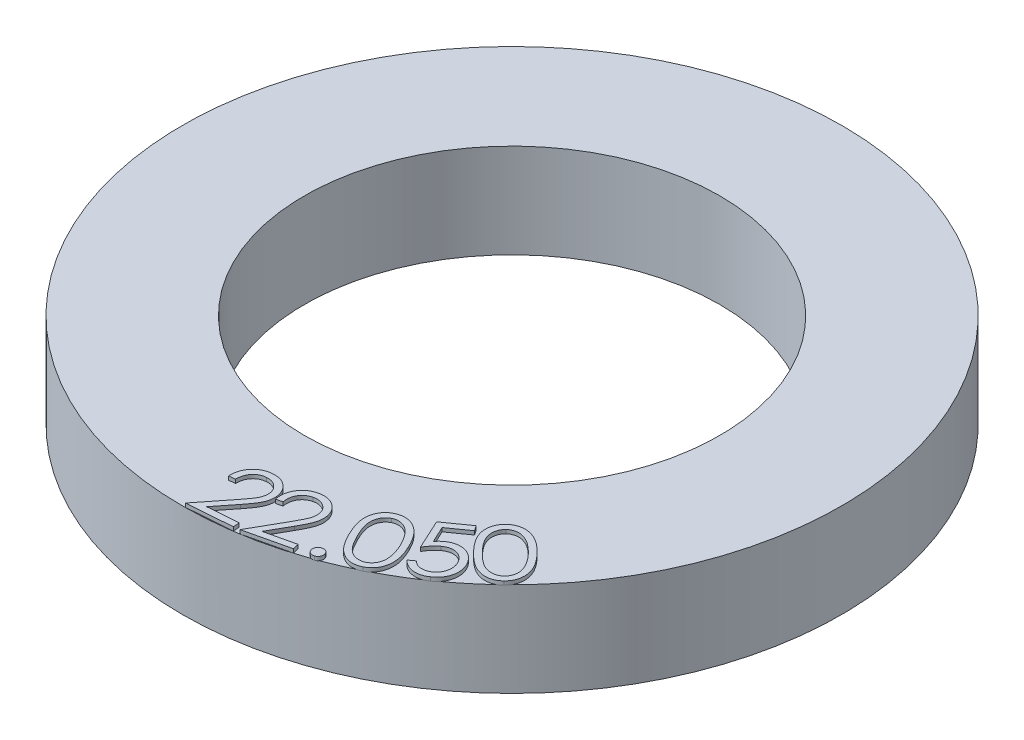
from build123d import *

# Parameters (mm, degrees)
SKETCH1_R           = 17.5
SKETCH1_R_2         = 11.025
BOSS_EXTRUDE1_DEPTH = 5
BOSS_EXTRUDE3_DEPTH = 0.2


with BuildPart() as part:
    # Sketch1 → Boss-Extrude1 (new body)
    with BuildSketch(Plane(origin=(0, 0, 0), x_dir=(1, 0, 0), z_dir=(0, 1, 0))):
        Circle(SKETCH1_R)
        Circle(SKETCH1_R_2, mode=Mode.SUBTRACT)
    extrude(amount=BOSS_EXTRUDE1_DEPTH)

    # Sketch3 → Boss-Extrude3 (add)
    # profile 1 of 6: a face of its own
    with BuildSketch(Plane(origin=(0, 5, 0), x_dir=(1, 0, 0), z_dir=(0, 1, 0))):
        with BuildLine():
            Line((0.377203526, -15.06640625), (0.043469551, -15.092347756))
            add(Edge.make_bspline(
                [(0.043469551, -15.092347756), (0.042203297, -15.050032699), (0.039723419, -14.96716131), (0.049638285, -14.844981972), (0.067688405, -14.727624407), (0.098455755, -14.61556583), (0.138504263, -14.508522308), (0.188279293, -14.405930448), (0.249943807, -14.309195828), (0.320224245, -14.217586795), (0.399116148, -14.133937543), (0.484222111, -14.059456033), (0.574336923, -13.993992114), (0.671078969, -13.940092371), (0.773224869, -13.895612995), (0.881084602, -13.861423192), (0.994390789, -13.836174987), (1.072362547, -13.828578994), (1.111979167, -13.824719551)],
                knots=[0, 0, 0, 0, 1.099165856, 2.152647473, 3.179901334, 4.180092559, 5.165857059, 6.14623908, 7.136854445, 8.141313093, 9.142222958, 10.119044223, 11.076246807, 12.030555843, 12.990566437, 13.966122304, 14.966608418, 16, 16, 16, 16], degree=3))
            add(Edge.make_bspline(
                [(1.111979167, -13.824719551), (1.151232363, -13.822614291), (1.227892409, -13.818502795), (1.341072803, -13.824300473), (1.449209712, -13.840047194), (1.552456645, -13.867170925), (1.650809554, -13.903432336), (1.744251767, -13.950064736), (1.832189716, -14.007297288), (1.914237577, -14.07371881), (1.989801801, -14.146775331), (2.056191283, -14.225750107), (2.115236363, -14.307662186), (2.163673815, -14.394967734), (2.203994369, -14.485852699), (2.23381166, -14.581483532), (2.256306856, -14.680631266), (2.263224051, -14.74868976), (2.266726763, -14.783153045)],
                knots=[0, 0, 0, 0, 1.125255338, 2.197582177, 3.23984224, 4.249678898, 5.249348258, 6.237204937, 7.234226399, 8.248247252, 9.256507582, 10.239567543, 11.199778339, 12.143800945, 13.093950023, 14.042329097, 15.008679649, 16, 16, 16, 16], degree=3))
            add(Edge.make_bspline(
                [(2.266726763, -14.783153045), (2.268653871, -14.83201524), (2.272472697, -14.928842275), (2.256591946, -15.073272294), (2.221554197, -15.213909987), (2.177756368, -15.329043673), (2.13210079, -15.422970742), (2.088829613, -15.499650514), (2.039151976, -15.583479859), (1.980752569, -15.67318269), (1.913642882, -15.76882397), (1.840613729, -15.872212721), (1.757921696, -15.980725817), (1.700055339, -16.055042687), (1.670072115, -16.093549679)],
                knots=[0, 0, 0, 0, 1.190284496, 2.358709392, 3.525773572, 4.713480732, 5.352743619, 6.06901355, 6.858115264, 7.726847504, 8.676217017, 9.704931629, 10.810819393, 12, 12, 12, 12], degree=3))
            Line((1.670072115, -16.093549679), (0.875701122, -17.094751603))
            Line((0.875701122, -17.094751603), (2.482672276, -16.971354167))
            Line((2.482672276, -16.971354167), (2.508613782, -17.307191506))
            Line((2.508613782, -17.307191506), (0.14443109, -17.488782051))
            Line((0.14443109, -17.488782051), (1.363681891, -15.949819712))
            add(Edge.make_bspline(
                [(1.363681891, -15.949819712), (1.393527022, -15.912554926), (1.450782044, -15.841066007), (1.530584566, -15.73612355), (1.602999147, -15.639675593), (1.666852925, -15.550639363), (1.722438282, -15.469396851), (1.76961629, -15.395481899), (1.809021619, -15.329602995), (1.849329165, -15.251857602), (1.888211722, -15.159145837), (1.917541309, -15.046099013), (1.933704742, -14.93175562), (1.93042781, -14.855174346), (1.928786058, -14.816806891)],
                knots=[0, 0, 0, 0, 1.323859622, 2.539697786, 3.655679983, 4.668207506, 5.577749991, 6.384956845, 7.099630202, 7.705429782, 8.812646299, 9.878423536, 10.93708365, 12, 12, 12, 12], degree=3))
            add(Edge.make_bspline(
                [(1.928786058, -14.816806891), (1.92620974, -14.792668697), (1.921140936, -14.745177743), (1.905685163, -14.675960851), (1.882668381, -14.610204079), (1.854314913, -14.54686504), (1.818130268, -14.487171166), (1.775716227, -14.430480301), (1.726271651, -14.377301953), (1.671340099, -14.327125852), (1.611934069, -14.281949704), (1.548780398, -14.24375581), (1.483443961, -14.212316408), (1.415907726, -14.186368957), (1.345139571, -14.169292508), (1.271999298, -14.157876025), (1.196114655, -14.153502913), (1.144924611, -14.156323447), (1.118990385, -14.157752404)],
                knots=[0, 0, 0, 0, 1.002985613, 1.973335034, 2.923515741, 3.878986154, 4.836651989, 5.802759845, 6.800988188, 7.833639541, 8.87511098, 9.880838076, 10.878972912, 11.86950441, 12.865345595, 13.881918786, 14.926924211, 16, 16, 16, 16], degree=3))
            add(Edge.make_bspline(
                [(1.118990385, -14.157752404), (1.091811261, -14.160540619), (1.038491161, -14.166010548), (0.960749235, -14.182373159), (0.886899306, -14.205342141), (0.817246391, -14.235736869), (0.751710741, -14.272344942), (0.690146343, -14.315288584), (0.633132276, -14.365692478), (0.580060436, -14.422065975), (0.532383632, -14.484564259), (0.490634628, -14.552362028), (0.455698611, -14.625546395), (0.426899376, -14.703718722), (0.404472482, -14.787020099), (0.388336351, -14.875402791), (0.379467781, -14.969236984), (0.377971809, -15.033435801), (0.377203526, -15.06640625)],
                knots=[0, 0, 0, 0, 1.003856858, 1.969369873, 2.914991585, 3.842326504, 4.757764574, 5.67065914, 6.596081697, 7.550367434, 8.512664105, 9.480773, 10.472199548, 11.488843046, 12.539268398, 13.639696742, 14.787824085, 16, 16, 16, 16], degree=3))
        make_face()
    # profile 2 of 6: a face of its own
    with BuildSketch(Plane(origin=(0, 5, 0), x_dir=(1, 0, 0), z_dir=(0, 1, 0))):
        with BuildLine():
            Line((2.680077799, -14.84254585), (2.355458408, -14.918267004))
            add(Edge.make_bspline(
                [(2.355458408, -14.918267004), (2.347994142, -14.876767046), (2.333387531, -14.795556953), (2.323472579, -14.673990721), (2.324976016, -14.555728299), (2.336513827, -14.440605451), (2.359783356, -14.328975701), (2.394590343, -14.221092867), (2.439601661, -14.116379831), (2.494569659, -14.015576781), (2.559832485, -13.921863348), (2.631188548, -13.834656401), (2.710921768, -13.757361702), (2.797573287, -13.688946733), (2.891342116, -13.629703088), (2.992353062, -13.580084855), (3.099856127, -13.537971321), (3.175300136, -13.518303724), (3.213631485, -13.508311075)],
                knots=[0, 0, 0, 0, 1.100238416, 2.153025381, 3.178012026, 4.183884262, 5.168591255, 6.148695239, 7.138002634, 8.140019377, 9.140121407, 10.114951831, 11.077023251, 12.032670763, 12.99234068, 13.966349905, 14.966749606, 16, 16, 16, 16], degree=3))
            add(Edge.make_bspline(
                [(3.213631485, -13.508311075), (3.251843088, -13.50036415), (3.32664053, -13.484808413), (3.438897548, -13.473770246), (3.547813259, -13.472847982), (3.653615731, -13.482442125), (3.755983303, -13.503477882), (3.854414489, -13.536291351), (3.950096274, -13.578421826), (4.040814221, -13.631584861), (4.126003653, -13.692404589), (4.204208412, -13.758970295), (4.274030899, -13.831494589), (4.335160407, -13.90960072), (4.388361962, -13.993145467), (4.432982751, -14.082231672), (4.470178835, -14.176708828), (4.487307474, -14.242643219), (4.495983248, -14.27603944)],
                knots=[0, 0, 0, 0, 1.121990491, 2.196244399, 3.238232453, 4.250969426, 5.246356061, 6.236987075, 7.230101134, 8.248200839, 9.255501669, 10.237657177, 11.19803806, 12.146105858, 13.086011545, 14.042029985, 15.008274769, 16, 16, 16, 16], degree=3))
            add(Edge.make_bspline(
                [(4.495983248, -14.27603944), (4.505415824, -14.323774993), (4.524110077, -14.41838123), (4.529985585, -14.56283772), (4.516844757, -14.706380405), (4.49162199, -14.826395359), (4.460506924, -14.925374116), (4.431085731, -15.007919873), (4.393488718, -15.097141834), (4.349829317, -15.194418504), (4.299347185, -15.299042154), (4.242538162, -15.411720311), (4.177915647, -15.531101044), (4.131979942, -15.612908193), (4.108262895, -15.655146011)],
                knots=[0, 0, 0, 0, 1.190223456, 2.358882579, 3.52524119, 4.712819824, 5.35365978, 6.065105631, 6.857984567, 7.723828008, 8.67607557, 9.702436758, 10.813745988, 12, 12, 12, 12], degree=3))
            Line((4.108262895, -15.655146011), (3.479356645, -16.761516203))
            Line((3.479356645, -16.761516203), (5.041456004, -16.394829504))
            Line((5.041456004, -16.394829504), (5.11787828, -16.721552261))
            Line((5.11787828, -16.721552261), (2.819601036, -17.260714921))
            Line((2.819601036, -17.260714921), (3.785045748, -15.56119569))
            add(Edge.make_bspline(
                [(3.785045748, -15.56119569), (3.808529371, -15.519892567), (3.8536226, -15.440582352), (3.91665988, -15.325551236), (3.973290102, -15.219474376), (4.021957514, -15.121779814), (4.064311127, -15.032979861), (4.100364837, -14.953571722), (4.128654637, -14.882434307), (4.156784414, -14.800101176), (4.179688984, -14.702577351), (4.192972915, -14.587024863), (4.189968714, -14.471889792), (4.175230987, -14.396958355), (4.167858248, -14.359472934)],
                knots=[0, 0, 0, 0, 1.322508168, 2.539478858, 3.65113322, 4.669382137, 5.577246142, 6.389686428, 7.096378664, 7.707362647, 8.810322298, 9.877140803, 10.938012216, 12, 12, 12, 12], degree=3))
            add(Edge.make_bspline(
                [(4.167858248, -14.359472934), (4.161829404, -14.336171476), (4.149935411, -14.290201239), (4.123387221, -14.224893717), (4.091995869, -14.16328915), (4.053584185, -14.106135055), (4.009399893, -14.052600205), (3.95860095, -14.003544562), (3.901957352, -13.958350343), (3.840235373, -13.917568468), (3.775029978, -13.881814057), (3.707248163, -13.853637752), (3.637912338, -13.832678602), (3.56741324, -13.817301491), (3.494890393, -13.811664684), (3.421495235, -13.811468351), (3.346244991, -13.818247864), (3.296509601, -13.82889709), (3.271123472, -13.834332709)],
                knots=[0, 0, 0, 0, 0.998805992, 1.97049261, 2.921394182, 3.866479787, 4.824835265, 5.799717433, 6.794315519, 7.830951375, 8.869177059, 9.878822869, 10.873799922, 11.875291578, 12.869368348, 13.888722291, 14.922353531, 16, 16, 16, 16], degree=3))
            add(Edge.make_bspline(
                [(3.271123472, -13.834332709), (3.244792519, -13.841064204), (3.193002937, -13.854304184), (3.119061623, -13.882705923), (3.050115946, -13.91714881), (2.986034959, -13.957311139), (2.926579811, -14.002814596), (2.87305675, -14.05555418), (2.823928987, -14.113545846), (2.780414933, -14.177443519), (2.743380272, -14.246402199), (2.712244756, -14.319205359), (2.689061885, -14.396615139), (2.673136557, -14.477873433), (2.664009273, -14.563501926), (2.662180891, -14.653056839), (2.666949138, -14.746824786), (2.675629023, -14.810109822), (2.680077799, -14.84254585)],
                knots=[0, 0, 0, 0, 1.001857296, 1.97052376, 2.915105733, 3.840812044, 4.756468097, 5.670946457, 6.606992161, 7.556283339, 8.516782409, 9.490308786, 10.47212129, 11.491627338, 12.540773751, 13.644567144, 14.792749573, 16, 16, 16, 16], degree=3))
        make_face()
    # profile 3 of 6: a face of its own
    with BuildSketch(Plane(origin=(0, 5, 0), x_dir=(1, 0, 0), z_dir=(0, 1, 0))):
        with BuildLine():
            add(Edge.make_bspline(
                [(5.812610444, -15.938128556), (5.831374417, -15.932374898), (5.868100028, -15.921113607), (5.925587729, -15.918820778), (5.982023209, -15.927326543), (6.036365652, -15.947186897), (6.086750753, -15.976062519), (6.129683552, -16.014781695), (6.164195697, -16.061839206), (6.179302393, -16.097844445), (6.187009483, -16.116213491)],
                knots=[0, 0, 0, 0, 1.018533362, 1.993514881, 2.966138152, 3.9748784, 4.989476654, 5.972026843, 6.965374611, 8, 8, 8, 8], degree=3))
            add(Edge.make_bspline(
                [(6.187009483, -16.116213491), (6.192680674, -16.134982532), (6.203852009, -16.171954526), (6.207259114, -16.229869607), (6.198423544, -16.286997519), (6.178873974, -16.341926891), (6.149719297, -16.392227049), (6.111823907, -16.435344643), (6.065578658, -16.469979456), (6.029886494, -16.484584723), (6.011729034, -16.492014773)],
                knots=[0, 0, 0, 0, 1.018247088, 2.005783202, 2.990165439, 4.010083513, 5.024396598, 5.998572224, 6.981825626, 8, 8, 8, 8], degree=3))
            add(Edge.make_bspline(
                [(6.011729034, -16.492014773), (5.992964701, -16.497770106), (5.956238387, -16.509034678), (5.898755786, -16.511303732), (5.842003107, -16.502843983), (5.787364663, -16.482393394), (5.737095106, -16.452595757), (5.694096527, -16.414271405), (5.660232144, -16.367416245), (5.645083379, -16.332037335), (5.637329996, -16.313929838)],
                knots=[0, 0, 0, 0, 1.019327242, 1.995068695, 2.968450063, 3.99358383, 5.015165017, 5.99848104, 6.975590248, 8, 8, 8, 8], degree=3))
            add(Edge.make_bspline(
                [(5.637329996, -16.313929838), (5.63125142, -16.294941947), (5.619366426, -16.257816312), (5.617673921, -16.1996281), (5.624612676, -16.142442807), (5.645777227, -16.087974496), (5.675371175, -16.038150206), (5.712952105, -15.994657098), (5.759716127, -15.961248414), (5.794765915, -15.945928316), (5.812610444, -15.938128556)],
                knots=[0, 0, 0, 0, 1.033330105, 2.02039479, 3.003248301, 4.016090021, 5.036799157, 6.01117572, 6.98745084, 8, 8, 8, 8], degree=3))
        make_face()
    # profile 4 of 6: a face of its own
    with BuildSketch(Plane(origin=(0, 5, 0), x_dir=(1, 0, 0), z_dir=(0, 1, 0))):
        with BuildLine():
            add(Edge.make_bspline(
                [(5.926947455, -14.591409929), (5.902562604, -14.54107518), (5.85522936, -14.443370795), (5.79150997, -14.298815349), (5.73552527, -14.161061187), (5.68880451, -14.029731846), (5.649785175, -13.905181613), (5.619188564, -13.787581207), (5.598248206, -13.676253217), (5.584287385, -13.571155334), (5.57919627, -13.47108959), (5.578665054, -13.375088526), (5.585236468, -13.282599638), (5.596759429, -13.193244945), (5.615243522, -13.107554057), (5.638984629, -13.024937828), (5.669080659, -12.945939741), (5.705037952, -12.870486318), (5.746241388, -12.799320862), (5.792128244, -12.732441223), (5.841764309, -12.669637867), (5.896918, -12.611949163), (5.956348177, -12.558875199), (6.020054728, -12.510092605), (6.08799113, -12.46547704), (6.13657505, -12.440412141), (6.161122135, -12.42774807)],
                knots=[0, 0, 0, 0, 1.645123066, 3.193335451, 4.646111031, 6.018177867, 7.292391992, 8.484572827, 9.590181928, 10.622806741, 11.60056216, 12.535521377, 13.445088631, 14.32596282, 15.183511051, 16.021124921, 16.852309999, 17.667186738, 18.477264483, 19.268601895, 20.051291864, 20.829318415, 21.613184976, 22.392819618, 23.187970152, 24, 24, 24, 24], degree=3))
            add(Edge.make_bspline(
                [(6.161122135, -12.42774807), (6.186416897, -12.41586994), (6.236684693, -12.392264759), (6.314501335, -12.36470959), (6.393107517, -12.342410836), (6.472661692, -12.327239889), (6.553271877, -12.31802542), (6.634653285, -12.314965493), (6.716867714, -12.319760089), (6.799919287, -12.329168963), (6.883174943, -12.34608104), (6.966155539, -12.37003131), (7.048434116, -12.401004867), (7.130041398, -12.439298027), (7.211645957, -12.48399607), (7.291888095, -12.537079899), (7.372445514, -12.595899887), (7.451524623, -12.663226038), (7.53177806, -12.737252896), (7.608868058, -12.82306367), (7.687194006, -12.916651425), (7.763230912, -13.021265261), (7.839890412, -13.134520908), (7.914580255, -13.258417499), (7.989117127, -13.391622555), (8.036262527, -13.484859722), (8.060461077, -13.532716019)],
                knots=[0, 0, 0, 0, 0.815522942, 1.620673105, 2.407127251, 3.199421702, 3.982404283, 4.774463597, 5.573925633, 6.384810166, 7.21322184, 8.051218599, 8.904223805, 9.7773812, 10.681457269, 11.618366128, 12.584685123, 13.592104133, 14.649390235, 15.769905354, 16.957308209, 18.211614585, 19.544051311, 20.949621683, 22.434317369, 24, 24, 24, 24], degree=3))
            add(Edge.make_bspline(
                [(8.060461077, -13.532716019), (8.083676138, -13.580713633), (8.128993329, -13.674407851), (8.189986589, -13.813715623), (8.242569299, -13.947824566), (8.287954881, -14.076234074), (8.324531496, -14.199551885), (8.352671313, -14.31777949), (8.373480479, -14.430525051), (8.385322509, -14.538568758), (8.390320998, -14.641835648), (8.388887915, -14.741112208), (8.381864174, -14.836623314), (8.369763594, -14.928867051), (8.349831198, -15.017102648), (8.32452604, -15.101672159), (8.293824693, -15.182756182), (8.256422815, -15.259593676), (8.214636304, -15.33273874), (8.167170913, -15.400767195), (8.116455338, -15.464808393), (8.060066422, -15.523313135), (8.000349089, -15.578371457), (7.93440333, -15.627080401), (7.865231211, -15.672537356), (7.816007071, -15.698189525), (7.791230308, -15.711101436)],
                knots=[0, 0, 0, 0, 1.558232882, 3.041763995, 4.443401513, 5.767654612, 7.021227995, 8.200860323, 9.318297212, 10.369822129, 11.375069383, 12.33829166, 13.269771564, 14.172997789, 15.054657955, 15.910430237, 16.751491526, 17.585533636, 18.405670074, 19.210937023, 20.007816759, 20.79051811, 21.583582897, 22.378674821, 23.183912799, 24, 24, 24, 24], degree=3))
            add(Edge.make_bspline(
                [(7.791230308, -15.711101436), (7.766431263, -15.723049141), (7.717237552, -15.746749729), (7.640310472, -15.773330086), (7.563501911, -15.795698202), (7.485255082, -15.810196549), (7.406564328, -15.819379889), (7.326812105, -15.822494414), (7.246466062, -15.817645125), (7.165277192, -15.808308799), (7.084054508, -15.791536491), (7.003686605, -15.76703736), (6.923501898, -15.737517425), (6.844908293, -15.698666716), (6.766125548, -15.654780159), (6.688246546, -15.603267844), (6.611014094, -15.544912142), (6.534220148, -15.479151896), (6.456832329, -15.405441295), (6.381864903, -15.319672676), (6.304752618, -15.225276524), (6.229634456, -15.118649086), (6.153134594, -15.002369804), (6.076551088, -14.875315765), (6.001358636, -14.737010675), (5.952205998, -14.640833451), (5.926947455, -14.591409929)],
                knots=[0, 0, 0, 0, 0.809697074, 1.60619104, 2.392486736, 3.162970989, 3.945555516, 4.723499003, 5.508921287, 6.312809801, 7.127809543, 7.946286757, 8.784564208, 9.640029567, 10.524148465, 11.438198645, 12.386286821, 13.372094412, 14.413385884, 15.529264195, 16.723043957, 18.000326053, 19.366637222, 20.82031953, 22.366026776, 24, 24, 24, 24], degree=3))
        make_face()
        with BuildLine():
            add(Edge.make_bspline(
                [(6.22562534, -14.45118557), (6.247152486, -14.493827643), (6.288803655, -14.576332411), (6.35272169, -14.694479999), (6.415628804, -14.802963612), (6.477380889, -14.902249227), (6.538074292, -14.992095397), (6.598302452, -15.072064949), (6.657300152, -15.142495557), (6.715154253, -15.20428425), (6.773356993, -15.258295423), (6.832211594, -15.305661688), (6.891283645, -15.348442721), (6.951848821, -15.38466198), (7.01274857, -15.416545018), (7.074663848, -15.442555872), (7.137258339, -15.463081318), (7.220515336, -15.482234019), (7.323218316, -15.494762827), (7.443001609, -15.490442581), (7.557614302, -15.469311729), (7.627402949, -15.438375811), (7.662223898, -15.422940378)],
                knots=[0, 0, 0, 0, 1.478025749, 2.859714887, 4.155866294, 5.357813273, 6.477029825, 7.509705812, 8.454142307, 9.318703752, 10.127220785, 10.908768663, 11.655271175, 12.382037597, 13.090364968, 13.780707852, 14.457625429, 15.125951693, 16.422103099, 17.645012841, 18.824982443, 20, 20, 20, 20], degree=3))
            add(Edge.make_bspline(
                [(7.662223898, -15.422940378), (7.695666028, -15.404167702), (7.762262313, -15.366784004), (7.849830918, -15.290711031), (7.923556971, -15.19859189), (7.975453415, -15.111638599), (8.009498706, -15.035307025), (8.030955763, -14.973978081), (8.045692424, -14.909427994), (8.057351835, -14.842303984), (8.063428775, -14.772191044), (8.064728732, -14.699121437), (8.061335756, -14.623220526), (8.055185686, -14.571981636), (8.052047616, -14.545837013)],
                knots=[0, 0, 0, 0, 1.340731954, 2.669918642, 4.031505281, 5.459277207, 6.2031686, 6.956503628, 7.73084967, 8.519472747, 9.341382062, 10.192884166, 11.077919835, 12, 12, 12, 12], degree=3))
            add(Edge.make_bspline(
                [(8.052047616, -14.545837013), (8.047542123, -14.512816325), (8.038356813, -14.44549733), (8.016640203, -14.343855874), (7.990145068, -14.239492631), (7.957765528, -14.132843356), (7.919616276, -14.023950886), (7.876351819, -13.91243756), (7.826277247, -13.798749286), (7.78959367, -13.722843789), (7.770897776, -13.684158327)],
                knots=[0, 0, 0, 0, 0.87813012, 1.790236412, 2.737444307, 3.715690557, 4.726763541, 5.778019856, 6.867561238, 8, 8, 8, 8], degree=3))
            add(Edge.make_bspline(
                [(7.770897776, -13.684158327), (7.751495288, -13.645943616), (7.713480783, -13.571071088), (7.654007285, -13.463559032), (7.594322423, -13.362519752), (7.533558645, -13.269082417), (7.472338944, -13.182085344), (7.41031568, -13.102536152), (7.347516997, -13.02984651), (7.284739052, -12.96389037), (7.221094369, -12.904952382), (7.158429057, -12.851090127), (7.094461394, -12.805095916), (7.031004629, -12.764865341), (6.968161982, -12.729991873), (6.904313039, -12.702753809), (6.840990823, -12.680572129), (6.757483054, -12.661740495), (6.655825475, -12.649226099), (6.537337092, -12.652317621), (6.424111869, -12.674071923), (6.354886924, -12.704301144), (6.320276782, -12.719414737)],
                knots=[0, 0, 0, 0, 1.327514374, 2.600944907, 3.805270884, 4.961891585, 6.052582967, 7.099609732, 8.08508515, 9.027220953, 9.918472679, 10.771259012, 11.585082234, 12.356317507, 13.09818, 13.808277843, 14.504248721, 15.173304686, 16.456493135, 17.666030037, 18.833093612, 20, 20, 20, 20], degree=3))
            add(Edge.make_bspline(
                [(6.320276782, -12.719414737), (6.286741276, -12.738087308), (6.219690272, -12.775421308), (6.132990995, -12.853606532), (6.056973433, -12.945724965), (6.005166709, -13.034477487), (5.970770692, -13.111929614), (5.949945228, -13.174009348), (5.933000712, -13.238371264), (5.921010975, -13.305655266), (5.914160476, -13.375737952), (5.91203772, -13.448600845), (5.915302483, -13.524183102), (5.921847264, -13.603197497), (5.935722059, -13.687026049), (5.956180897, -13.776661244), (5.983906988, -13.872967535), (6.018289256, -13.975888076), (6.060009389, -14.085445407), (6.10837012, -14.201666646), (6.163943113, -14.32457598), (6.204611149, -14.408051619), (6.22562534, -14.45118557)],
                knots=[0, 0, 0, 0, 1.184359405, 2.368012177, 3.585550163, 4.869153856, 5.53289479, 6.205207044, 6.892746875, 7.590628501, 8.317360586, 9.069723882, 9.844008581, 10.657130917, 11.521409538, 12.470468649, 13.500510027, 14.621004524, 15.827064187, 17.127021726, 18.515460256, 20, 20, 20, 20], degree=3))
        make_face(mode=Mode.SUBTRACT)
    # profile 5 of 6: a face of its own
    with BuildSketch(Plane(origin=(0, 5, 0), x_dir=(1, 0, 0), z_dir=(0, 1, 0))):
        with BuildLine():
            Line((8.905820544, -10.81501346), (9.096525672, -11.084945351))
            Line((9.096525672, -11.084945351), (8.086209166, -11.800089582))
            Line((8.086209166, -11.800089582), (8.492859807, -12.672285095))
            add(Edge.make_bspline(
                [(8.492859807, -12.672285095), (8.51705623, -12.642776), (8.563899554, -12.58564755), (8.637538854, -12.507497305), (8.711727906, -12.439832324), (8.763205185, -12.400830704), (8.788032083, -12.382020672)],
                knots=[0, 0, 0, 0, 1.102510947, 2.134417912, 3.100251258, 4, 4, 4, 4], degree=3))
            add(Edge.make_bspline(
                [(8.788032083, -12.382020672), (8.820109592, -12.360315139), (8.883205401, -12.317620797), (8.983169841, -12.26619245), (9.084104752, -12.224617519), (9.186966618, -12.195460631), (9.291137291, -12.175799501), (9.397000003, -12.169368235), (9.504117602, -12.17260687), (9.611627853, -12.187634211), (9.717726072, -12.212338375), (9.819983806, -12.248599798), (9.917768605, -12.294202417), (10.010991446, -12.349865714), (10.099073358, -12.41645699), (10.182463758, -12.493131992), (10.261523131, -12.579753693), (10.309056949, -12.643349646), (10.333304519, -12.675790704)],
                knots=[0, 0, 0, 0, 1.053566777, 2.072344485, 3.054154547, 4.020735706, 4.977911009, 5.934388254, 6.901994919, 7.890871114, 8.884708514, 9.862655974, 10.838946315, 11.817700602, 12.812779523, 13.839512687, 14.897909552, 16, 16, 16, 16], degree=3))
            add(Edge.make_bspline(
                [(10.333304519, -12.675790704), (10.349205912, -12.699235475), (10.380632976, -12.745571055), (10.423192032, -12.817357695), (10.459224738, -12.891028059), (10.491272613, -12.965765182), (10.517783682, -13.042191306), (10.539530664, -13.120165711), (10.556617195, -13.199483347), (10.567516839, -13.279906402), (10.573828031, -13.360199115), (10.575483147, -13.439359499), (10.571252868, -13.517165799), (10.561309826, -13.593496762), (10.546565491, -13.668675023), (10.527043258, -13.742588506), (10.501668394, -13.814991678), (10.470823211, -13.885694753), (10.434827501, -13.954330198), (10.394959037, -14.021481751), (10.349312851, -14.085808807), (10.298517314, -14.147707169), (10.243212212, -14.207138609), (10.183172699, -14.264412663), (10.117967443, -14.319086296), (10.07151531, -14.353130068), (10.047947948, -14.370402082)],
                knots=[0, 0, 0, 0, 1.058904501, 2.092788817, 3.116471482, 4.122554999, 5.131063365, 6.137943179, 7.147208115, 8.161602767, 9.169391864, 10.156790113, 11.119252309, 12.079372117, 13.032029688, 13.98143675, 14.934695052, 15.8971969, 16.862391289, 17.830310157, 18.8144563, 19.807827508, 20.821657655, 21.847463179, 22.90791634, 24, 24, 24, 24], degree=3))
            add(Edge.make_bspline(
                [(10.047947948, -14.370402082), (10.019295417, -14.389862779), (9.9629447, -14.428135985), (9.874220463, -14.475514725), (9.784619171, -14.514890612), (9.693300776, -14.543872575), (9.600833617, -14.565819682), (9.506736536, -14.576358654), (9.411483019, -14.579568571), (9.315757613, -14.572902652), (9.220893158, -14.558560064), (9.128752094, -14.535160072), (9.039718529, -14.504233334), (8.953938577, -14.464936554), (8.871663046, -14.416729616), (8.792363016, -14.361250194), (8.715925142, -14.298110264), (8.669349113, -14.25026174), (8.645704358, -14.225970992)],
                knots=[0, 0, 0, 0, 1.073683973, 2.111606131, 3.114875596, 4.105229039, 5.079452871, 6.057740752, 7.036807216, 8.032083212, 9.029653356, 10.008961322, 10.976446223, 11.949563641, 12.930560464, 13.930051518, 14.949171403, 16, 16, 16, 16], degree=3))
            Line((8.645704358, -14.225970992), (8.937371025, -14.019140063))
            add(Edge.make_bspline(
                [(8.937371025, -14.019140063), (8.961635196, -14.041499254), (9.008383198, -14.084577071), (9.084201285, -14.136832231), (9.158803392, -14.179407726), (9.235041453, -14.209553815), (9.313100915, -14.227387514), (9.393294113, -14.236939881), (9.476366447, -14.235735942), (9.561361266, -14.22584273), (9.646348642, -14.207698302), (9.727651661, -14.178066609), (9.806271974, -14.142161027), (9.854122513, -14.110262042), (9.878276474, -14.094160095)],
                knots=[0, 0, 0, 0, 1.151762453, 2.219016371, 3.209870592, 4.148730593, 5.071934365, 6.000972824, 6.96479679, 7.967796459, 8.988367636, 9.993261107, 10.987039746, 12, 12, 12, 12], degree=3))
            add(Edge.make_bspline(
                [(9.878276474, -14.094160095), (9.900886283, -14.077356933), (9.945405903, -14.044270835), (10.004473384, -13.986657554), (10.056761909, -13.924757469), (10.101869674, -13.857739049), (10.139855962, -13.785798618), (10.170813452, -13.70926527), (10.193994743, -13.627662559), (10.20968222, -13.542453), (10.218603156, -13.455173936), (10.217315446, -13.367835639), (10.20950095, -13.281560177), (10.191643449, -13.196474173), (10.164432518, -13.112986445), (10.130312958, -13.029818023), (10.086624929, -12.948209386), (10.051682837, -12.896353989), (10.033925512, -12.870001441)],
                knots=[0, 0, 0, 0, 0.982901861, 1.935373165, 2.873857243, 3.808820726, 4.750847603, 5.710288131, 6.686831843, 7.708192972, 8.733167937, 9.745322852, 10.754049183, 11.754552243, 12.77418333, 13.817071584, 14.890651141, 16, 16, 16, 16], degree=3))
            add(Edge.make_bspline(
                [(10.033925512, -12.870001441), (10.016739606, -12.847064194), (9.983082244, -12.802143243), (9.927637085, -12.740434092), (9.86765414, -12.687621005), (9.80579606, -12.640216037), (9.739646488, -12.601869214), (9.670297945, -12.570688083), (9.597665974, -12.546894842), (9.522347996, -12.5298286), (9.445441033, -12.521871147), (9.368323581, -12.520522825), (9.291542529, -12.52961606), (9.214665448, -12.545586206), (9.137880173, -12.5704209), (9.061599494, -12.60370084), (8.984937331, -12.64432096), (8.936360282, -12.677627418), (8.911429519, -12.694720992)],
                knots=[0, 0, 0, 0, 1.074776657, 2.104872872, 3.104341879, 4.068556333, 5.023200681, 5.964838422, 6.915611592, 7.885388104, 8.855323063, 9.81081214, 10.772033681, 11.748521529, 12.752018427, 13.792504925, 14.867067091, 16, 16, 16, 16], degree=3))
            add(Edge.make_bspline(
                [(8.911429519, -12.694720992), (8.890466825, -12.710638616), (8.8473348, -12.7433901), (8.783963328, -12.798012343), (8.722079492, -12.860916409), (8.659124859, -12.929738637), (8.597107702, -13.006394604), (8.534604702, -13.08968846), (8.472995615, -13.18061774), (8.432856237, -13.24405509), (8.412230801, -13.276652082)],
                knots=[0, 0, 0, 0, 0.818651868, 1.684426275, 2.599403717, 3.561756698, 4.584719662, 5.664970434, 6.800155744, 8, 8, 8, 8], degree=3))
            Line((8.412230801, -13.276652082), (7.678156281, -11.683703364))
            Line((7.678156281, -11.683703364), (8.905820544, -10.81501346))
        make_face()
    # profile 6 of 6: a face of its own
    with BuildSketch(Plane(origin=(0, 5, 0), x_dir=(1, 0, 0), z_dir=(0, 1, 0))):
        with BuildLine():
            add(Edge.make_bspline(
                [(10.061528562, -12.10955222), (10.022956902, -12.068877282), (9.948043998, -11.989879446), (9.843004253, -11.871191764), (9.746856726, -11.757152028), (9.662558794, -11.645801129), (9.587265593, -11.538869256), (9.523014434, -11.435213056), (9.467760847, -11.335853691), (9.423120937, -11.239404772), (9.387161115, -11.145589547), (9.358439609, -11.053481538), (9.335685504, -10.96320001), (9.320265408, -10.874124207), (9.310912512, -10.786766665), (9.308712669, -10.700467974), (9.313761542, -10.61585785), (9.324855221, -10.532846238), (9.342571358, -10.452301381), (9.365447521, -10.37404815), (9.395206402, -10.299293261), (9.429624987, -10.226848525), (9.470387016, -10.157948288), (9.51591285, -10.091366706), (9.568349735, -10.028763459), (9.606703214, -9.989578446), (9.626131928, -9.969728502)],
                knots=[0, 0, 0, 0, 1.643143098, 3.191270976, 4.645664262, 6.014553529, 7.284140096, 8.478046464, 9.588014013, 10.61488382, 11.590779053, 12.531207317, 13.441789177, 14.318091217, 15.179101305, 16.015191765, 16.845564482, 17.661395641, 18.467677819, 19.261049258, 20.048571613, 20.823839802, 21.609930406, 22.392909899, 23.185896688, 24, 24, 24, 24], degree=3))
            add(Edge.make_bspline(
                [(9.626131928, -9.969728502), (9.646645091, -9.95069727), (9.687318886, -9.912961868), (9.752951978, -9.86262558), (9.82097751, -9.817156486), (9.892700351, -9.779015734), (9.966623737, -9.745702257), (10.043514762, -9.718255129), (10.123183777, -9.696568041), (10.20571016, -9.68103803), (10.290338148, -9.672191802), (10.376851129, -9.668875627), (10.464943764, -9.674490451), (10.554730722, -9.68541183), (10.646285721, -9.703999117), (10.739509478, -9.729242319), (10.834274843, -9.761744286), (10.930937146, -9.801087051), (11.029460742, -9.849217028), (11.13026139, -9.90588491), (11.233052994, -9.972445027), (11.338150651, -10.048209415), (11.4454711, -10.133940855), (11.554567784, -10.229792228), (11.66690382, -10.33373637), (11.740312315, -10.408325038), (11.777874716, -10.446491322)],
                knots=[0, 0, 0, 0, 0.814307392, 1.614620432, 2.405388273, 3.193927934, 3.97672154, 4.764468093, 5.568360162, 6.378448907, 7.206542137, 8.043948668, 8.895854568, 9.773619782, 10.675734413, 11.613311544, 12.583794371, 13.590896081, 14.649966002, 15.774206342, 16.955777189, 18.213503254, 19.545065278, 20.953335129, 22.441051684, 24, 24, 24, 24], degree=3))
            add(Edge.make_bspline(
                [(11.777874716, -10.446491322), (11.814854184, -10.485255248), (11.887044241, -10.560928863), (11.987574534, -10.675759496), (12.079295527, -10.787542626), (12.161694512, -10.896673681), (12.23353433, -11.004058588), (12.297534335, -11.10782118), (12.35070381, -11.20969791), (12.395436672, -11.308899574), (12.430866619, -11.406229864), (12.460879856, -11.501034296), (12.483379386, -11.594506766), (12.498899769, -11.686339274), (12.507460043, -11.776558786), (12.508968567, -11.865183233), (12.503213493, -11.952124966), (12.491394927, -12.037228558), (12.473097417, -12.119669422), (12.449411404, -12.199534266), (12.418928204, -12.275666565), (12.384035539, -12.349408099), (12.342167974, -12.419239764), (12.296135004, -12.487072917), (12.243421183, -12.551026654), (12.204245084, -12.590356211), (12.184525357, -12.610153181)],
                knots=[0, 0, 0, 0, 1.560920867, 3.047176545, 4.445805626, 5.773746473, 7.029772118, 8.209369219, 9.324227381, 10.375918751, 11.377815375, 12.340623291, 13.272194005, 14.176790602, 15.052286813, 15.910448986, 16.756638747, 17.588735874, 18.411585632, 19.215188949, 20.013145761, 20.798980117, 21.589668162, 22.383020387, 23.186075276, 24, 24, 24, 24], degree=3))
            add(Edge.make_bspline(
                [(12.184525357, -12.610153181), (12.16424862, -12.628954402), (12.124046156, -12.666231375), (12.059224592, -12.715701109), (11.992305933, -12.76050639), (11.922365456, -12.798903796), (11.849611869, -12.831325824), (11.774360209, -12.858062908), (11.696280994, -12.878994313), (11.615756722, -12.894783135), (11.532904199, -12.902798821), (11.448531042, -12.905134253), (11.36269871, -12.900118518), (11.275611133, -12.887862414), (11.186983445, -12.869740367), (11.096865638, -12.844171226), (11.005431965, -12.811821524), (10.911644662, -12.773094239), (10.81603972, -12.725093808), (10.717752152, -12.667036278), (10.615902013, -12.59978748), (10.511364422, -12.521162265), (10.402950549, -12.433133181), (10.291585958, -12.334444112), (10.176237024, -12.226733802), (10.100490943, -12.149354631), (10.061528562, -12.10955222)],
                knots=[0, 0, 0, 0, 0.811064481, 1.60808856, 2.389888403, 3.172620267, 3.946285432, 4.725040954, 5.513640096, 6.316661342, 7.130129069, 7.953396753, 8.791500303, 9.649899588, 10.53226685, 11.444204777, 12.396439187, 13.377193406, 14.420034322, 15.532790691, 16.725465982, 17.999767269, 19.369752981, 20.822718841, 22.365665447, 24, 24, 24, 24], degree=3))
        make_face()
        with BuildLine():
            add(Edge.make_bspline(
                [(10.304116703, -11.884492124), (10.337578269, -11.918574154), (10.402540546, -11.984741), (10.500104054, -12.077699958), (10.593067011, -12.162957402), (10.682719911, -12.238661617), (10.768464434, -12.305349323), (10.849584809, -12.364159763), (10.927584923, -12.413096761), (11.001701443, -12.454772772), (11.07418007, -12.487466292), (11.144334876, -12.516073575), (11.213934525, -12.538566035), (11.282589858, -12.555420101), (11.350311854, -12.566903194), (11.41715019, -12.572295009), (11.483263045, -12.573321261), (11.568750426, -12.566641613), (11.670517579, -12.54720082), (11.783580906, -12.506905605), (11.886149609, -12.450915311), (11.943927533, -12.400472609), (11.972786575, -12.37527738)],
                knots=[0, 0, 0, 0, 1.473957898, 2.861541556, 4.158429599, 5.366384119, 6.48165494, 7.510449078, 8.456966946, 9.322163817, 10.132208232, 10.909042953, 11.659478826, 12.387214262, 13.089187375, 13.776821919, 14.454856839, 15.127538109, 16.420448759, 17.638738311, 18.820591935, 20, 20, 20, 20], degree=3))
            add(Edge.make_bspline(
                [(11.972786575, -12.37527738), (11.999096913, -12.347144569), (12.051476146, -12.291137113), (12.111356623, -12.191364249), (12.15518686, -12.081272391), (12.177418612, -11.982136745), (12.186980934, -11.898714603), (12.188238906, -11.833712734), (12.183968496, -11.767351683), (12.174006317, -11.699854924), (12.158528791, -11.630950783), (12.137058338, -11.560904501), (12.111550388, -11.488878351), (12.089791002, -11.44169194), (12.078655966, -11.417545008)],
                knots=[0, 0, 0, 0, 1.340944698, 2.669583919, 4.030928969, 5.461188359, 6.19962706, 6.958188698, 7.726289627, 8.517420774, 9.336470106, 10.187844869, 11.072657056, 12, 12, 12, 12], degree=3))
            add(Edge.make_bspline(
                [(12.078655966, -11.417545008), (12.063987821, -11.387250039), (12.034271656, -11.325875523), (11.983464173, -11.23492443), (11.925602706, -11.144183163), (11.862651218, -11.051783909), (11.792167981, -10.959745433), (11.716675467, -10.866265116), (11.634371449, -10.772887308), (11.576158741, -10.711789779), (11.546504524, -10.680666002)],
                knots=[0, 0, 0, 0, 0.884558049, 1.79202434, 2.736150632, 3.71244019, 4.72966929, 5.78206634, 6.87015931, 8, 8, 8, 8], degree=3))
            add(Edge.make_bspline(
                [(11.546504524, -10.680666002), (11.516301384, -10.650102624), (11.457161501, -10.590257369), (11.367546578, -10.505677176), (11.279867397, -10.427540032), (11.193607132, -10.35629109), (11.10797441, -10.292846712), (11.024755152, -10.235143983), (10.943159202, -10.184037211), (10.862523381, -10.140895389), (10.783992203, -10.103457249), (10.707158132, -10.072406083), (10.632416474, -10.047329921), (10.559769283, -10.027135588), (10.488709433, -10.013658365), (10.419504972, -10.006866602), (10.352163725, -10.004956096), (10.266745298, -10.012015905), (10.165243051, -10.030256677), (10.053220513, -10.071098865), (9.951222655, -10.125903849), (9.89428322, -10.176093731), (9.865915582, -10.201098694)],
                knots=[0, 0, 0, 0, 1.326591129, 2.597559181, 3.803812624, 4.952220953, 6.050454968, 7.093242857, 8.07839134, 9.021111463, 9.915189371, 10.763364664, 11.577972641, 12.348162485, 13.089731918, 13.807721709, 14.493365527, 15.166324271, 16.451327591, 17.663329693, 18.835853919, 20, 20, 20, 20], degree=3))
            add(Edge.make_bspline(
                [(9.865915582, -10.201098694), (9.839602185, -10.229223864), (9.787080212, -10.285362167), (9.727011752, -10.385763893), (9.684471656, -10.497426589), (9.661850945, -10.597731936), (9.65250305, -10.682110796), (9.65111291, -10.747808025), (9.655590871, -10.814344744), (9.664646974, -10.88234401), (9.679586891, -10.951369214), (9.699237993, -11.021928223), (9.724553286, -11.09336078), (9.755832937, -11.166465722), (9.794229351, -11.242469839), (9.841254557, -11.321957006), (9.897038472, -11.40550307), (9.961236995, -11.493358688), (10.033850008, -11.585802517), (10.116607022, -11.681586658), (10.206493435, -11.782641277), (10.270939053, -11.849877715), (10.304116703, -11.884492124)],
                knots=[0, 0, 0, 0, 1.185970551, 2.367216757, 3.582004018, 4.861034475, 5.528469342, 6.19936335, 6.885891938, 7.584587042, 8.314486342, 9.063449579, 9.843573315, 10.65137712, 11.515794273, 12.469475821, 13.499641158, 14.614767356, 15.826768159, 17.126133982, 18.52048713, 20, 20, 20, 20], degree=3))
        make_face(mode=Mode.SUBTRACT)
    extrude(amount=BOSS_EXTRUDE3_DEPTH)


solid = part.part
